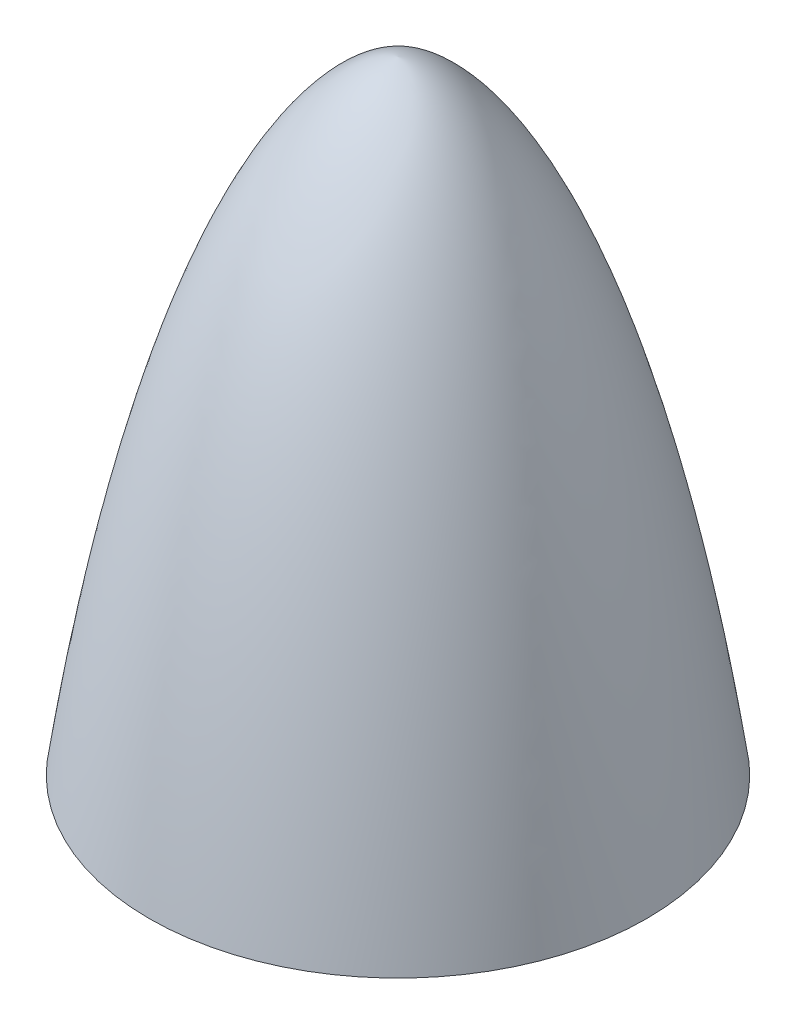
from build123d import *


with BuildPart() as part:
    # Sketch1 → Revolve4 (revolve)
    with BuildSketch(Plane.XY):
        with BuildLine():
            Line((0, 635), (0, 0))
            Line((0, 0), (254, 0))
            add(Edge.make_bspline(
                [(0, 635), (69.16573013, 624.460149905), (184.953292607, 483.383268854), (254, 0)],
                knots=[0, 0, 0, 0, 1, 1, 1, 1], degree=3))
        make_face()
    revolve(axis=Axis((0, 635, 0), (0, -1, 0)))


solid = part.part
